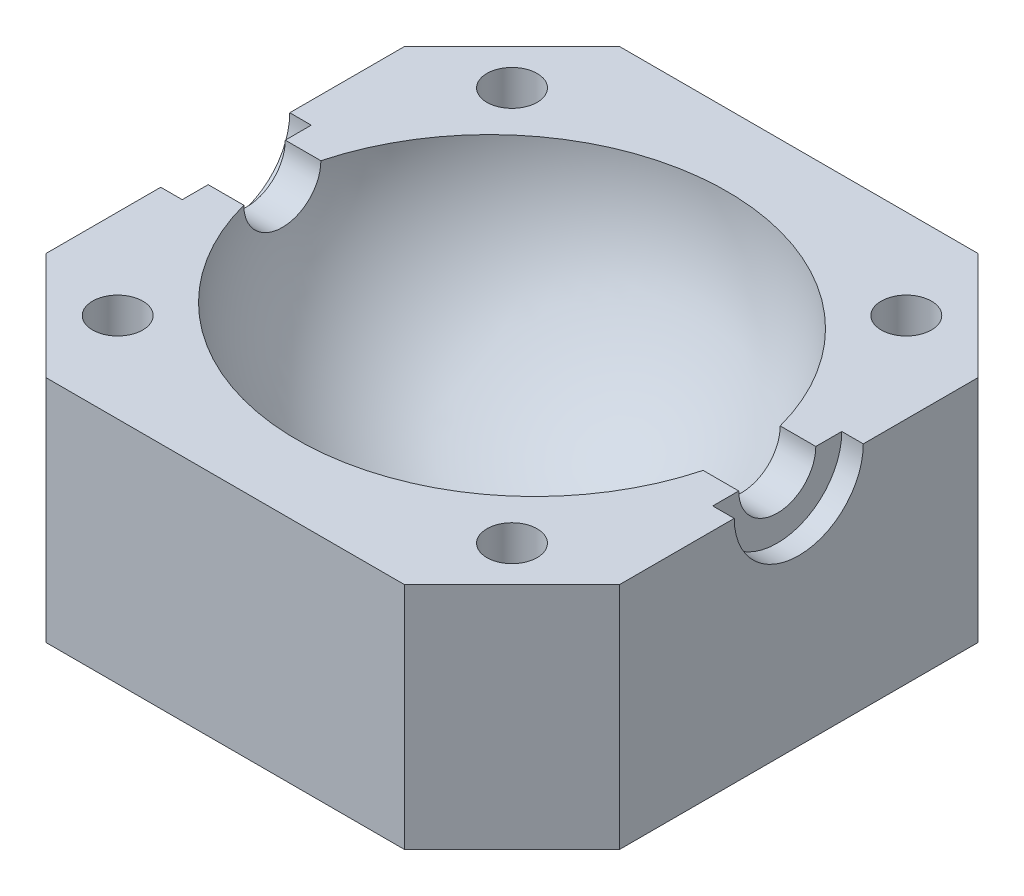
from build123d import *

# Parameters (mm, degrees)
SKETCH1_W           = 80
SKETCH1_H           = 80
BOSS_EXTRUDE1_DEPTH = 32
SKETCH3_R           = 5.375
CUT_EXTRUDE1_DEPTH  = 95.994736856
CHAMFER1_SIZE       = 15
SKETCH4_R           = 3.5
CUT_EXTRUDE2_DEPTH  = 7.5
SKETCH5_R           = 9
CUT_EXTRUDE3_DEPTH  = 93.482430925


with BuildPart() as part:
    # Sketch1 → Boss-Extrude1 (new body)
    with BuildSketch(Plane(origin=(0, 0, 0), x_dir=(1, 0, 0), z_dir=(0, 1, 0))):
        Rectangle(SKETCH1_W, SKETCH1_H)
    extrude(amount=BOSS_EXTRUDE1_DEPTH)

    # Sketch2 → Cut-Revolve1 (revolve, cut)
    with BuildSketch(Plane(origin=(0, 32, 0), x_dir=(1, 0, 0), z_dir=(0, 1, 0))):
        with BuildLine():
            Line((-33, 0), (33, 0))
            ThreePointArc((33, 0), (0, -30), (-33, 0))
        make_face()
    revolve(axis=Axis((-33, 32, 0), (1, 0, 0)), mode=Mode.SUBTRACT)

    # Sketch3 → Cut-Extrude1 (cut, through all)
    with BuildSketch(Plane.ZY.offset(40)):
        with Locations((0, 32)):
            Circle(SKETCH3_R)
    extrude(amount=-CUT_EXTRUDE1_DEPTH, mode=Mode.SUBTRACT)

    # Chamfer1
    chamfer1_edges = [part.edges().sort_by_distance(p)[0] for p in [
        (40, 16, 40),
        (-40, 16, 40),
        (-40, 16, -40),
        (40, 16, -40),
    ]]
    chamfer(chamfer1_edges, length=CHAMFER1_SIZE)

    # Sketch4 → Cut-Extrude2 (cut)
    with BuildSketch(Plane(origin=(0, 32, 0), x_dir=(1, 0, 0), z_dir=(0, 1, 0))):
        with Locations(Location((-27.5, 27.5, 0), (0, 0, 270))):
            Circle(SKETCH4_R)
        with Locations(Location((27.5, 27.5, 0), (0, 0, 270))):
            Circle(SKETCH4_R)
        with Locations(Location((27.5, -27.5, 0), (0, 0, 270))):
            Circle(SKETCH4_R)
        with Locations(Location((-27.5, -27.5, 0), (0, 0, 270))):
            Circle(SKETCH4_R)
    extrude(amount=-CUT_EXTRUDE2_DEPTH, mode=Mode.SUBTRACT)

    # Sketch5 → Cut-Extrude3 (cut, through all)
    with BuildSketch(Plane.ZY.offset(37)):
        with Locations((0, 32)):
            Circle(SKETCH5_R)
    cut_extrude3 = extrude(amount=CUT_EXTRUDE3_DEPTH, mode=Mode.SUBTRACT)

    # Mirror1: Cut-Extrude3 across plane
    add(cut_extrude3.mirror(Plane(origin=(0, 0, 0), x_dir=(0, 0, 1), z_dir=(1, 0, 0))), mode=Mode.SUBTRACT)


solid = part.part
